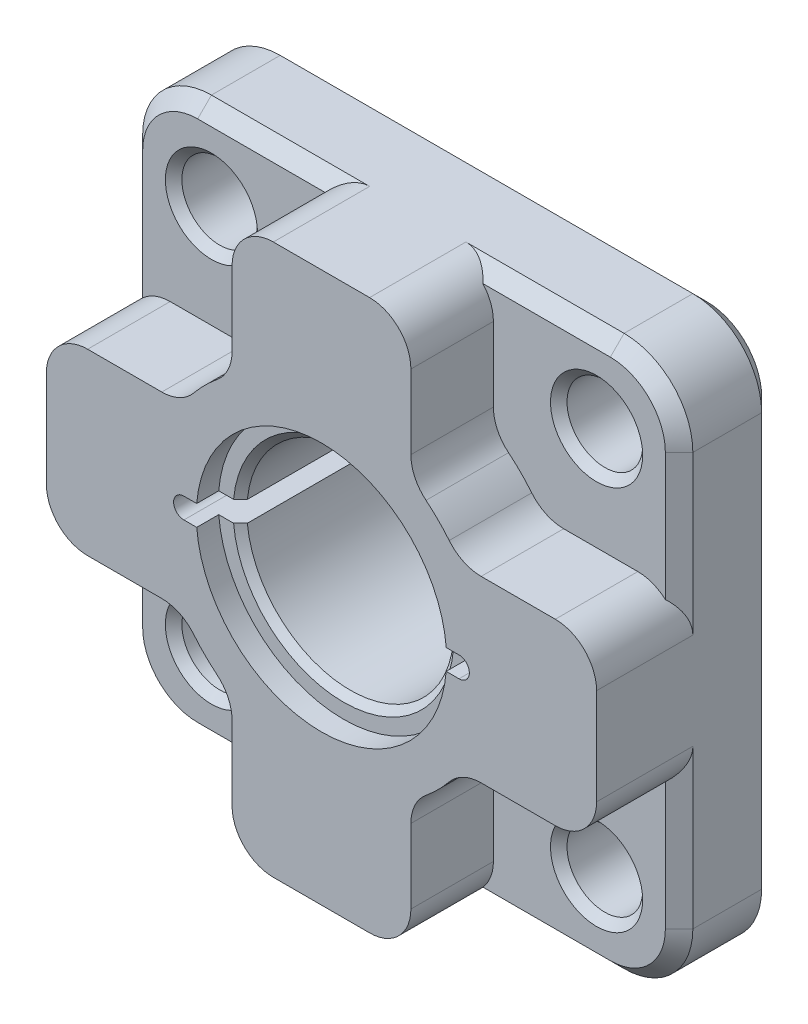
from build123d import *

# Parameters (mm, degrees)
SZKIC1_W                    = 40
SZKIC1_H                    = 40
DODANIE_WYCI_GNI_CIE1_DEPTH = 13
OTW_R_POD_RUB_M51_D         = 5.5
SZKIC4_R                    = 6.05
WYTNIJ_WYCI_GNI_CIE1_DEPTH  = 32.128764833
WYTNIJ_WYCI_GNI_CIE2_START  = -6
SZKIC5_R                    = 2.75
WYTNIJ_WYCI_GNI_CIE2_DEPTH  = 6
SZYK_KO_OWY1_COUNT          = 4
ZAOKR_GLENIE1_R             = 5
ZAOKR_GLENIE2_R             = 3
SFAZOWANIE2_SIZE            = 1
SFAZOWANIE3_SIZE            = 0.6
SFAZOWANIE4_SIZE            = 0.5


with BuildPart() as part:
    # Szkic1 → Dodanie-wyciągnięcie1 (new body)
    with BuildSketch(Plane.XY):
        Rectangle(SZKIC1_W, SZKIC1_H)
    extrude(amount=DODANIE_WYCI_GNI_CIE1_DEPTH)

    # Otwór pod śrubę M51 (through all)
    with Locations(Plane.XY.offset(13)):
        with Locations((-14, 14), (14, 14), (14, -14), (-14, -14)):
            Hole(OTW_R_POD_RUB_M51_D / 2)

    # Szkic4 → Wytnij-wyciągnięcie1 (cut, through all)
    with BuildSketch(Plane.XY.offset(13)):
        Circle(SZKIC4_R)
        with BuildLine():
            Line((-10, 0.75), (10, 0.75))
            ThreePointArc((10, 0.75), (10.75, 0), (10, -0.75))
            Line((10, -0.75), (-10, -0.75))
            ThreePointArc((-10, -0.75), (-10.75, 0), (-10, 0.75))
        make_face()
    extrude(amount=-WYTNIJ_WYCI_GNI_CIE1_DEPTH, mode=Mode.SUBTRACT)

    # Szkic5 → Wytnij-wyciągnięcie2 (cut)
    with BuildSketch(Plane.XY.offset(13).offset(WYTNIJ_WYCI_GNI_CIE2_START)):
        with BuildLine():
            Line((6.5, 20), (6.5, 10.087120501))
            ThreePointArc((6.5, 10.087120501), (8.485281374, 8.485281374), (10.087120501, 6.5))
            Line((10.087120501, 6.5), (20, 6.5))
            Line((20, 6.5), (20, 20))
            Line((20, 20), (6.5, 20))
        make_face()
        with Locations((14, 14)):
            Circle(SZKIC5_R, mode=Mode.SUBTRACT)
    wytnij_wyci_gni_cie2 = extrude(amount=WYTNIJ_WYCI_GNI_CIE2_DEPTH, mode=Mode.SUBTRACT)

    # Szyk kołowy1: Wytnij-wyciągnięcie2 ×4 about axis
    szyk_ko_owy1_axis = Axis((0, 0, 0), (0, 0, 1))
    for i in range(1, SZYK_KO_OWY1_COUNT):
        add(wytnij_wyci_gni_cie2.rotate(szyk_ko_owy1_axis, i * 360 / SZYK_KO_OWY1_COUNT), mode=Mode.SUBTRACT)

    # Zaokrąglenie1
    zaokr_glenie1_edges = [part.edges().sort_by_distance(p)[0] for p in [
        (20, 20, 3.5),
        (20, -20, 3.5),
        (-20, -20, 3.5),
        (-20, 20, 3.5),
    ]]
    fillet(zaokr_glenie1_edges, radius=ZAOKR_GLENIE1_R)

    # Zaokrąglenie2
    zaokr_glenie2_edges = [part.edges().sort_by_distance(p)[0] for p in [
        (-10.087120501, -6.5, 10),
        (-6.5, -10.087120501, 10),
        (-6.5, -20, 10),
        (-20, -6.5, 10),
        (-6.5, 10.087120501, 10),
        (-10.087120501, 6.5, 10),
        (-20, 6.5, 10),
        (-6.5, 20, 10),
        (10.087120501, 6.5, 10),
        (6.5, 10.087120501, 10),
        (6.5, 20, 10),
        (20, 6.5, 10),
        (6.5, -10.087120501, 10),
        (10.087120501, -6.5, 10),
        (20, -6.5, 10),
        (6.5, -20, 10),
    ]]
    fillet(zaokr_glenie2_edges, radius=ZAOKR_GLENIE2_R)

    # Sfazowanie2
    sfazowanie2_edges = [part.edges().sort_by_distance(p)[0] for p in [
        (-9.25, -20, 7),
        (-20, 9.25, 7),
        (-20, 0, 0),
        (-20, -9.25, 7),
        (20, 0, 0),
        (0, -20, 0),
        (0, 20, 0),
        (18.535533906, 18.535533906, 0),
        (18.535533906, -18.535533906, 0),
        (-18.535533906, -18.535533906, 0),
        (-18.535533906, 18.535533906, 0),
        (-9.25, 20, 7),
        (-18.535533906, 18.535533906, 7),
        (9.25, -20, 7),
        (-18.535533906, -18.535533906, 7),
        (20, 9.25, 7),
        (18.535533906, -18.535533906, 7),
        (18.535533906, 18.535533906, 7),
        (9.25, 20, 7),
        (20, -9.25, 7),
    ]]
    chamfer(sfazowanie2_edges, length=SFAZOWANIE2_SIZE)

    # Sfazowanie3
    sfazowanie3_edges = [part.edges().sort_by_distance(p)[0] for p in [
        (-11.25, -14, 7),
        (-11.25, 14, 7),
        (-11.25, -14, 0),
        (16.75, -14, 0),
        (16.75, 14, 0),
        (-11.25, 14, 0),
        (16.75, 14, 7),
        (16.75, -14, 7),
    ]]
    chamfer(sfazowanie3_edges, length=SFAZOWANIE3_SIZE)

    # Szkic6 → Wycięcie-obrót1 (revolve, cut)
    with BuildSketch(Plane(origin=(0, 0, 0), x_dir=(0, 0, -1), z_dir=(1, 0, 0))):
        Polygon((-13, 9.1), (-11.4, 9.1), (-11.4, 7.525), (0, 7.525), (0, 0), (-13, 0), align=None)
    revolve(axis=Axis((0, 0, 0), (0, 0, -1)), mode=Mode.SUBTRACT)

    # Sfazowanie4
    sfazowanie4_edges = [part.edges().sort_by_distance(p)[0] for p in [
        (0, -7.525, 11.4),
        (0, -7.525, 0),
        (0, 7.525, 11.4),
        (0, 7.525, 0),
    ]]
    chamfer(sfazowanie4_edges, length=SFAZOWANIE4_SIZE)


solid = part.part
